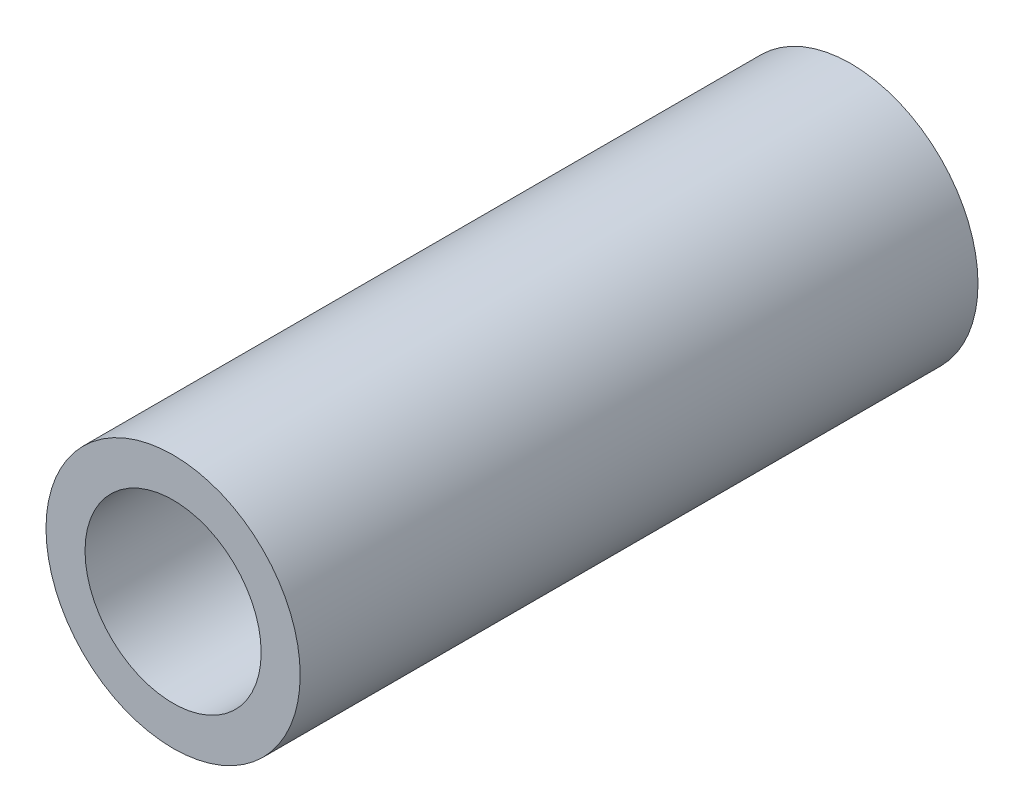
from build123d import *

# Parameters (mm, degrees)
SKETCH1_R             = 2.38125
BOSS_EXTRUDE1_DEPTH   = 12.7
M4X0_7_TAPPED_HOLE1_D = 3.3


with BuildPart() as part:
    # Sketch1 → Boss-Extrude1 (new body)
    with BuildSketch(Plane.XY):
        Circle(SKETCH1_R)
    extrude(amount=-BOSS_EXTRUDE1_DEPTH)

    # M4x0.7 Tapped Hole1 (through all)
    with Locations(Plane.XY):
        with Locations((0, 0)):
            Hole(M4X0_7_TAPPED_HOLE1_D / 2)


solid = part.part
